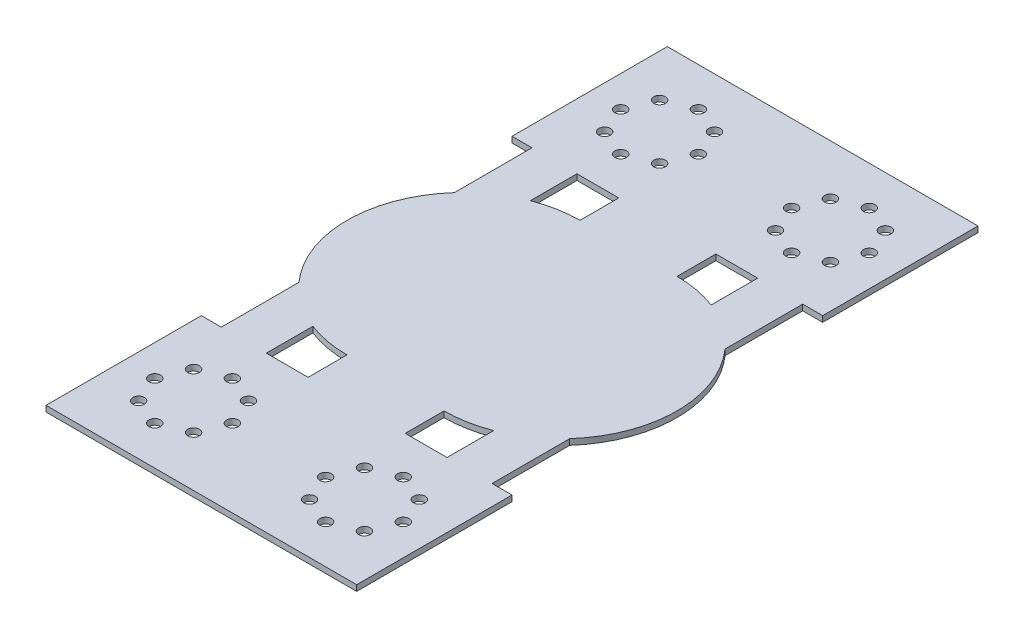
from build123d import *

# Parameters (mm, degrees)
SALIENTE_EXTRUIR1_DEPTH = 1.5
CROQUIS2_R              = 1.5
CORTAR_EXTRUIR1_DEPTH   = 1.5


with BuildPart() as part:
    # Croquis1 → Saliente-Extruir1 (new body)
    with BuildSketch(Plane(origin=(0, 0, 0), x_dir=(1, 0, 0), z_dir=(0, 1, 0))):
        with BuildLine():
            ThreePointArc((23.270329614, 12), (29.541594579, 15.310243942), (34.860679775, 20))
            ThreePointArc((34.860679775, 20), (42.5, 40), (34.860679775, 60))
            ThreePointArc((34.860679775, 60), (29.541594579, 64.689756058), (23.270329614, 68))
            ThreePointArc((23.270329614, 68), (17.977225575, 69.495762408), (12.5, 70))
            Line((12.5, 70), (12.5, 10))
            ThreePointArc((12.5, 10), (17.977225575, 10.504237592), (23.270329614, 12))
        make_face()
        Polygon((-40, 0), (-40, -40), (40, -40), (40, 0), (34.860679775, 0), (23.270329614, 0), (12.5, 0), (12.5, 10), (12.5, 70), (12.5, 80), (23.270329614, 80), (34.860679775, 80), (40, 80), (40, 120), (-40, 120), (-40, 80), (-34.860679775, 80), (-23.270329614, 80), (-12.5, 80), (-12.5, 70), (-12.5, 40), (-12.5, 10), (-12.5, 0), (-23.270329614, 0), (-34.860679775, 0), align=None)
        with BuildLine():
            ThreePointArc((-34.860679775, 60), (-42.5, 40), (-34.860679775, 20))
            ThreePointArc((-34.860679775, 20), (-29.541594579, 15.310243942), (-23.270329614, 12))
            ThreePointArc((-23.270329614, 12), (-17.977225575, 10.504237592), (-12.5, 10))
            Line((-12.5, 10), (-12.5, 40))
            Line((-12.5, 40), (-12.5, 70))
            ThreePointArc((-12.5, 70), (-17.977225575, 69.495762408), (-23.270329614, 68))
            ThreePointArc((-23.270329614, 68), (-29.541594579, 64.689756058), (-34.860679775, 60))
        make_face()
        with BuildLine():
            Line((23.270329614, 0), (34.860679775, 0))
            Line((34.860679775, 0), (34.860679775, 20))
            ThreePointArc((34.860679775, 20), (29.541594579, 15.310243942), (23.270329614, 12))
            Line((23.270329614, 12), (23.270329614, 0))
        make_face()
        with BuildLine():
            ThreePointArc((23.270329614, 68), (29.541594579, 64.689756058), (34.860679775, 60))
            Line((34.860679775, 60), (34.860679775, 80))
            Line((34.860679775, 80), (23.270329614, 80))
            Line((23.270329614, 80), (23.270329614, 68))
        make_face()
        with BuildLine():
            Line((-34.860679775, 80), (-34.860679775, 60))
            ThreePointArc((-34.860679775, 60), (-29.541594579, 64.689756058), (-23.270329614, 68))
            Line((-23.270329614, 68), (-23.270329614, 80))
            Line((-23.270329614, 80), (-34.860679775, 80))
        make_face()
        with BuildLine():
            Line((-34.860679775, 20), (-34.860679775, 0))
            Line((-34.860679775, 0), (-23.270329614, 0))
            Line((-23.270329614, 0), (-23.270329614, 12))
            ThreePointArc((-23.270329614, 12), (-29.541594579, 15.310243942), (-34.860679775, 20))
        make_face()
    extrude(amount=SALIENTE_EXTRUIR1_DEPTH)

    # Croquis2 → Cortar-Extruir1 (cut)
    with BuildSketch(Plane(origin=(0, 1.5, 0), x_dir=(1, 0, 0), z_dir=(0, 1, 0))):
        with Locations(Location((32, -20, 0), (0, 0, 270))):
            Circle(CROQUIS2_R)
        with Locations(Location((29.071067812, -27.071067812, 0), (0, 0, 270))):
            Circle(CROQUIS2_R)
        with Locations(Location((22, -30, 0), (0, 0, 270))):
            Circle(CROQUIS2_R)
        with Locations(Location((14.928932188, -27.071067812, 0), (0, 0, 270))):
            Circle(CROQUIS2_R)
        with Locations(Location((12, -20, 0), (0, 0, 270))):
            Circle(CROQUIS2_R)
        with Locations(Location((14.928932188, -12.928932188, 0), (0, 0, 270))):
            Circle(CROQUIS2_R)
        with Locations(Location((22, -10, 0), (0, 0, 270))):
            Circle(CROQUIS2_R)
        with Locations(Location((29.071067812, -12.928932188, 0), (0, 0, 270))):
            Circle(CROQUIS2_R)
        with Locations(Location((-29.071067812, -12.928932188, 0), (0, 0, 90))):
            Circle(CROQUIS2_R)
        with Locations(Location((-22, -10, 0), (0, 0, 90))):
            Circle(CROQUIS2_R)
        with Locations(Location((-14.928932188, -12.928932188, 0), (0, 0, 90))):
            Circle(CROQUIS2_R)
        with Locations(Location((-12, -20, 0), (0, 0, 90))):
            Circle(CROQUIS2_R)
        with Locations(Location((-14.928932188, -27.071067812, 0), (0, 0, 90))):
            Circle(CROQUIS2_R)
        with Locations(Location((-22, -30, 0), (0, 0, 90))):
            Circle(CROQUIS2_R)
        with Locations(Location((-29.071067812, -27.071067812, 0), (0, 0, 90))):
            Circle(CROQUIS2_R)
        with Locations(Location((-32, -20, 0), (0, 0, 90))):
            Circle(CROQUIS2_R)
        with Locations(Location((-32, 100, 0), (0, 0, 270))):
            Circle(CROQUIS2_R)
        with Locations(Location((-29.071067812, 107.071067812, 0), (0, 0, 270))):
            Circle(CROQUIS2_R)
        with Locations(Location((-22, 110, 0), (0, 0, 270))):
            Circle(CROQUIS2_R)
        with Locations(Location((-14.928932188, 107.071067812, 0), (0, 0, 270))):
            Circle(CROQUIS2_R)
        with Locations(Location((-12, 100, 0), (0, 0, 270))):
            Circle(CROQUIS2_R)
        with Locations(Location((-14.928932188, 92.928932188, 0), (0, 0, 270))):
            Circle(CROQUIS2_R)
        with Locations(Location((-22, 90, 0), (0, 0, 270))):
            Circle(CROQUIS2_R)
        with Locations(Location((-29.071067812, 92.928932188, 0), (0, 0, 270))):
            Circle(CROQUIS2_R)
        with Locations(Location((29.071067812, 92.928932188, 0), (0, 0, 90))):
            Circle(CROQUIS2_R)
        with Locations(Location((22, 90, 0), (0, 0, 90))):
            Circle(CROQUIS2_R)
        with Locations(Location((14.928932188, 92.928932188, 0), (0, 0, 90))):
            Circle(CROQUIS2_R)
        with Locations(Location((12, 100, 0), (0, 0, 90))):
            Circle(CROQUIS2_R)
        with Locations(Location((14.928932188, 107.071067812, 0), (0, 0, 90))):
            Circle(CROQUIS2_R)
        with Locations(Location((22, 110, 0), (0, 0, 90))):
            Circle(CROQUIS2_R)
        with Locations(Location((29.071067812, 107.071067812, 0), (0, 0, 90))):
            Circle(CROQUIS2_R)
        with Locations(Location((32, 100, 0), (0, 0, 90))):
            Circle(CROQUIS2_R)
    extrude(amount=-CORTAR_EXTRUIR1_DEPTH, mode=Mode.SUBTRACT)


solid = part.part
